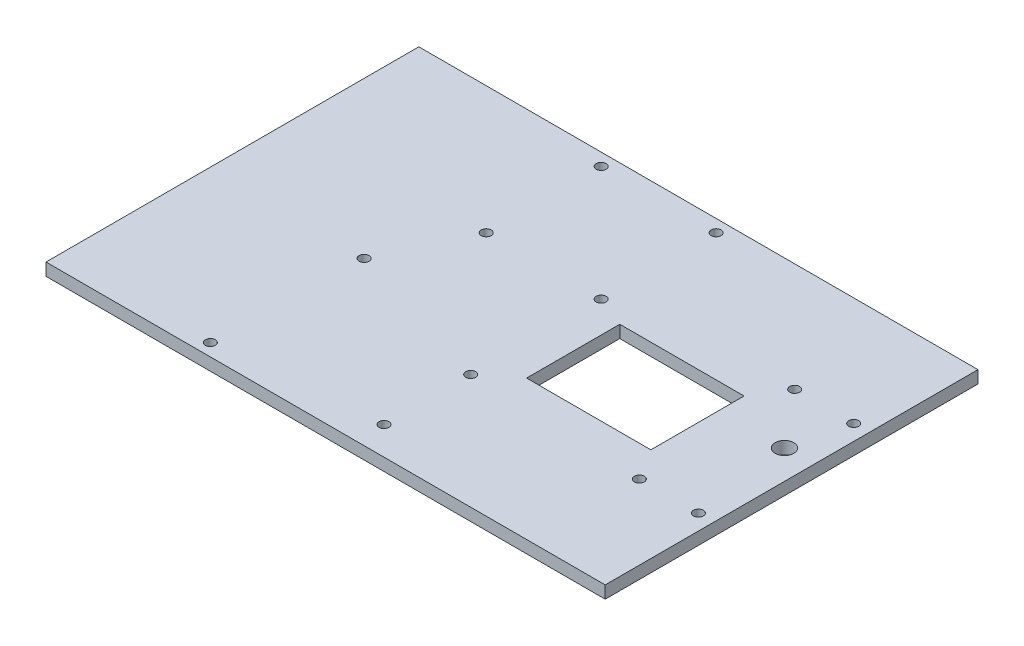
from build123d import *

# Parameters (mm, degrees)
SKETCH_1_W          = 180
SKETCH_1_H          = 120
EXTRUDE_1_DEPTH     = 4
SKETCH_2_R          = 1.6
SKETCH_2_R_2        = 3
CUT_EXTRUDE_1_DEPTH = 4
SKETCH_3_W          = 40
SKETCH_3_H          = 30
CUT_EXTRUDE_2_DEPTH = 4
SKETCH_4_R          = 1.6
CUT_EXTRUDE_3_DEPTH = 4
SKETCH_5_R          = 1.6
CUT_EXTRUDE_4_DEPTH = 4


with BuildPart() as part:
    # 草图1 → 凸台-拉伸1 (new body)
    with BuildSketch(Plane(origin=(0, 0, 0), x_dir=(1, 0, 0), z_dir=(0, 1, 0))):
        Rectangle(SKETCH_1_W, SKETCH_1_H)
    extrude(amount=EXTRUDE_1_DEPTH)

    # 草图2 → 切除-拉伸1 (cut)
    with BuildSketch(Plane(origin=(0, 4, 0), x_dir=(1, 0, 0), z_dir=(0, 1, 0))):
        with Locations(Location((66, 25, 0), (0, 0, 270))):
            Circle(SKETCH_2_R)
        with Locations(Location((66, -25, 0), (0, 0, 270))):
            Circle(SKETCH_2_R)
        with Locations(Location((85, -25, 0), (0, 0, 270))):
            Circle(SKETCH_2_R)
        with Locations(Location((85, 25, 0), (0, 0, 270))):
            Circle(SKETCH_2_R)
        with Locations(Location((80.7, 7, 0), (0, 0, 270))):
            Circle(SKETCH_2_R_2)
    extrude(amount=-CUT_EXTRUDE_1_DEPTH, mode=Mode.SUBTRACT)

    # 草图3 → 切除-拉伸2 (cut)
    with BuildSketch(Plane(origin=(0, 4, 0), x_dir=(1, 0, 0), z_dir=(0, 1, 0))):
        with Locations((39.7, 0)):
            Rectangle(SKETCH_3_W, SKETCH_3_H)
    extrude(amount=-CUT_EXTRUDE_2_DEPTH, mode=Mode.SUBTRACT)

    # 草图4 → 切除-拉伸3 (cut)
    with BuildSketch(Plane(origin=(0, 4, 0), x_dir=(1, 0, 0), z_dir=(0, 1, 0))):
        with Locations(Location((-27.3, 56, 0), (0, 0, 270))):
            Circle(SKETCH_4_R)
        with Locations(Location((9.7, 56, 0), (0, 0, 270))):
            Circle(SKETCH_4_R)
        with Locations(Location((9.7, 19, 0), (0, 0, 270))):
            Circle(SKETCH_4_R)
        with Locations(Location((-27.3, 19, 0), (0, 0, 270))):
            Circle(SKETCH_4_R)
    extrude(amount=-CUT_EXTRUDE_3_DEPTH, mode=Mode.SUBTRACT)

    # 草图5 → 切除-拉伸4 (cut)
    with BuildSketch(Plane(origin=(0, 4, 0), x_dir=(1, 0, 0), z_dir=(0, 1, 0))):
        with Locations(Location((-39.8, -7.8, 0), (0, 0, 270))):
            Circle(SKETCH_5_R)
        with Locations(Location((9.7, -23, 0), (0, 0, 270))):
            Circle(SKETCH_5_R)
        with Locations(Location((9.7, -50.9, 0), (0, 0, 270))):
            Circle(SKETCH_5_R)
        with Locations(Location((-41.1, -56, 0), (0, 0, 270))):
            Circle(SKETCH_5_R)
    extrude(amount=-CUT_EXTRUDE_4_DEPTH, mode=Mode.SUBTRACT)


solid = part.part
